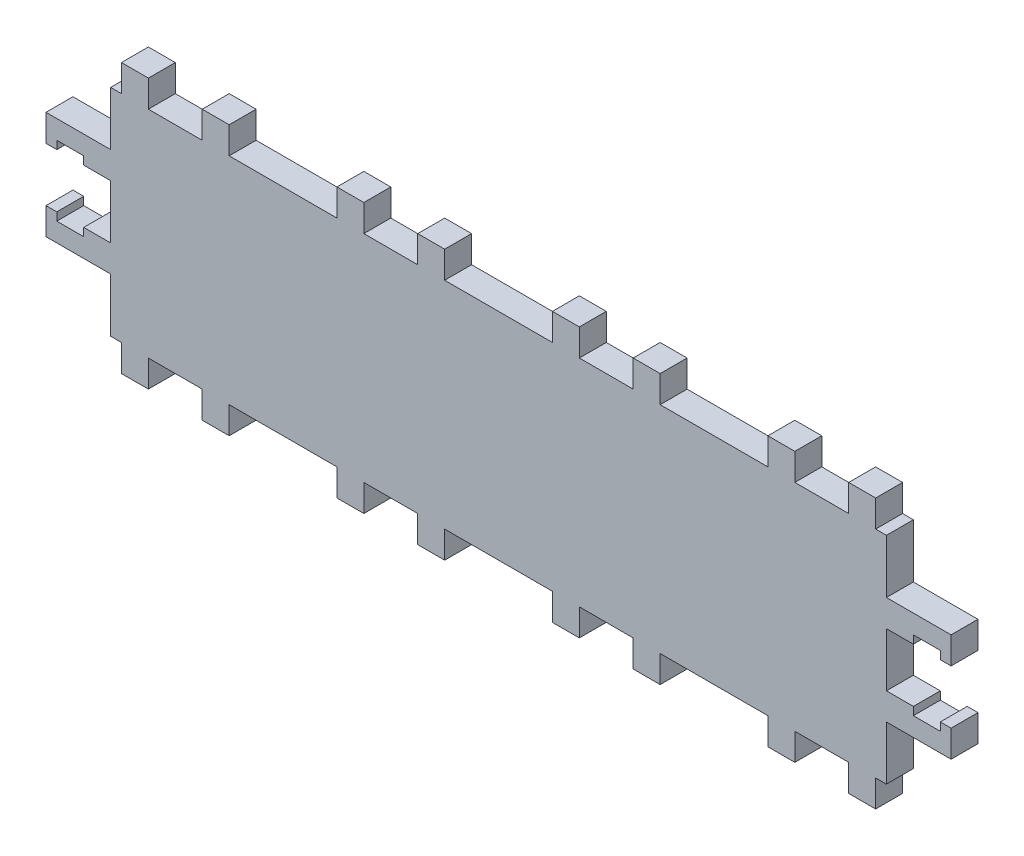
from build123d import *

# Parameters (mm, degrees)
BOSS_EXTRU_1_DEPTH = 5


with BuildPart() as part:
    # Esquisse1 → Boss.-Extru.1 (new body)
    with BuildSketch(Plane.XY):
        Polygon((-70, 40), (-72, 40), (-72, 30), (-84, 30), (-84, 25), (-82, 25), (-82, 26.5), (-77, 26.5), (-77, 25), (-72, 25), (-72, 15), (-77, 15), (-77, 13.5), (-82, 13.5), (-82, 15), (-84, 15), (-84, 10), (-72, 10), (-72, 0), (-70, 0), (-70, -5), (-65, -5), (-65, 0), (-55, 0), (-55, -5), (-50, -5), (-50, 0), (-30, 0), (-30, -5), (-25, -5), (-25, 0), (-15, 0), (-15, -5), (-10, -5), (-10, 0), (10, 0), (10, -5), (15, -5), (15, 0), (25, 0), (25, -5), (30, -5), (30, 0), (50, 0), (50, -5), (55, -5), (55, 0), (65, 0), (65, -5), (70, -5), (70, 0), (72, 0), (72, 10), (84, 10), (84, 15), (82, 15), (82, 13.5), (77, 13.5), (77, 15), (72, 15), (72, 25), (77, 25), (77, 26.5), (82, 26.5), (82, 25), (84, 25), (84, 30), (72, 30), (72, 40), (70, 40), (70, 45), (65, 45), (65, 40), (55, 40), (55, 45), (50, 45), (50, 40), (30, 40), (30, 45), (25, 45), (25, 40), (15, 40), (15, 45), (10, 45), (10, 40), (-10, 40), (-10, 45), (-15, 45), (-15, 40), (-25, 40), (-25, 45), (-30, 45), (-30, 40), (-50, 40), (-50, 45), (-55, 45), (-55, 40), (-65, 40), (-65, 45), (-70, 45), align=None)
    extrude(amount=BOSS_EXTRU_1_DEPTH)


solid = part.part
